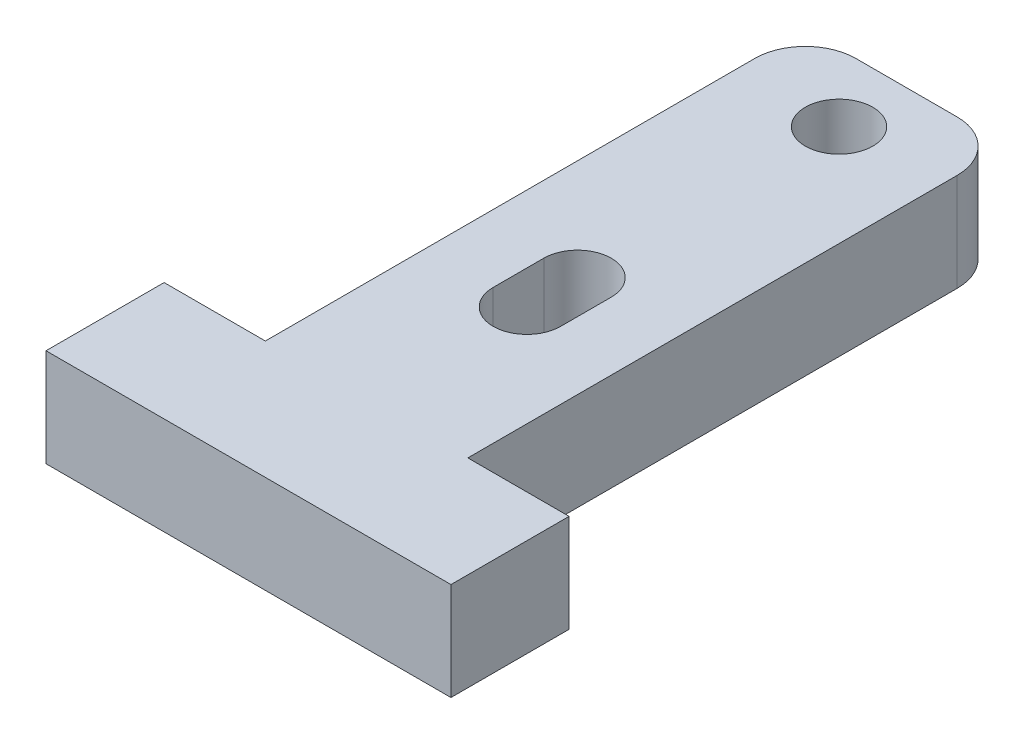
from build123d import *

# Parameters (mm, degrees)
SKETCH1_R           = 2
BOSS_EXTRUDE1_DEPTH = 5.8


with BuildPart() as part:
    # Sketch1 → Boss-Extrude1 (new body)
    with BuildSketch(Plane(origin=(0, 0, 0), x_dir=(1, 0, 0), z_dir=(0, 1, 0))):
        with BuildLine():
            Line((6, -18.624423913), (12, -18.624423913))
            Line((12, -18.624423913), (12, -25.624423913))
            Line((12, -25.624423913), (-12, -25.624423913))
            Line((-12, -25.624423913), (-12, -18.624423913))
            Line((-12, -18.624423913), (-6, -18.624423913))
            Line((-6, -18.624423913), (-6, 10.375576087))
            ThreePointArc((-6, 10.375576087), (-5.121320344, 12.496896431), (-3, 13.375576087))
            Line((-3, 13.375576087), (3, 13.375576087))
            ThreePointArc((3, 13.375576087), (5.121320344, 12.496896431), (6, 10.375576087))
            Line((6, 10.375576087), (6, -18.624423913))
        make_face()
        with Locations(Location((0, 9.375576087, 0), (0, 0, 270))):
            Circle(SKETCH1_R, mode=Mode.SUBTRACT)
        with BuildLine():
            Line((-2, -9.124423913), (-2, -6.124423913))
            ThreePointArc((-2, -6.124423913), (0, -4.124423913), (2, -6.124423913))
            Line((2, -6.124423913), (2, -9.124423913))
            ThreePointArc((2, -9.124423913), (0, -11.124423913), (-2, -9.124423913))
        make_face(mode=Mode.SUBTRACT)
    extrude(amount=BOSS_EXTRUDE1_DEPTH)


solid = part.part
